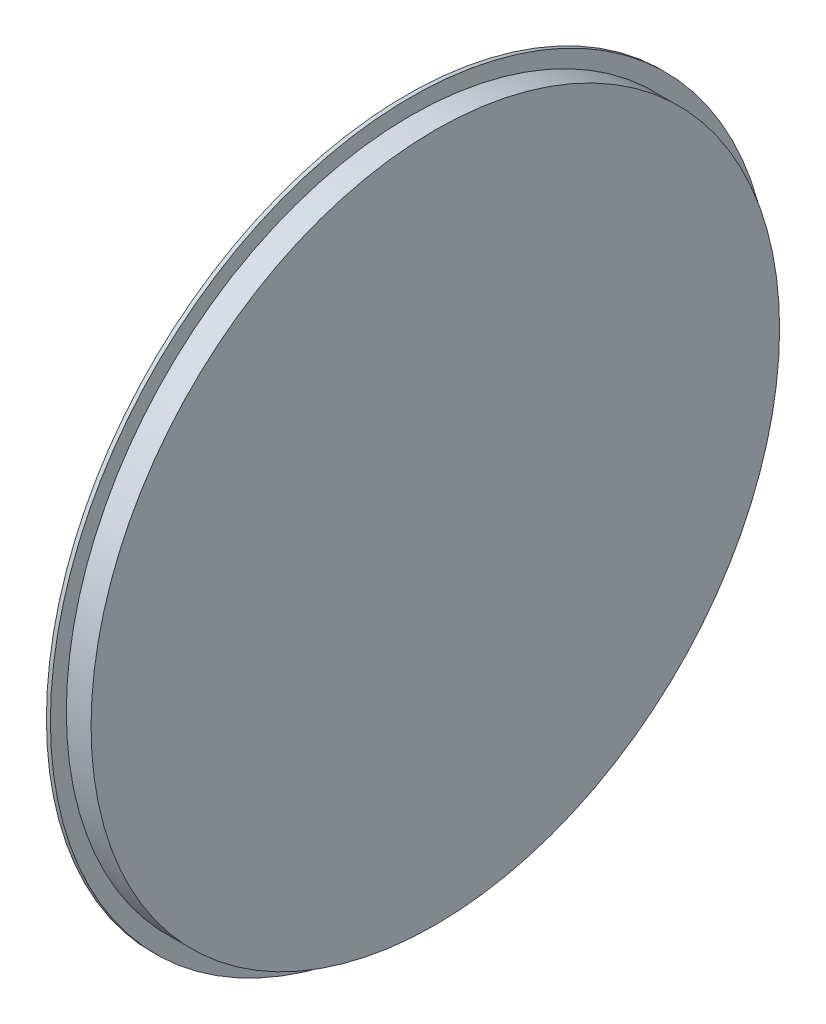
from build123d import *

# Parameters (mm, degrees)
SKETCH2_W          = 6.838461538
SKETCH2_H          = 38.1
CUT_EXTRUDE1_DEPTH = 1.27


with BuildPart() as part:
    # Sketch1 → Revolve1 (revolve)
    with BuildSketch(Plane.XY, mode=Mode.PRIVATE) as revolve1_sk:
        Polygon((0, 0), (0, 274.193), (-19.685, 274.193), (-19.685, 286.893), (-22.86, 286.893), (-22.86, 0), align=None)
    revolve(revolve1_sk.sketch.rotate(Axis((0, 0, 0), (1, 0, 0)), 90), axis=Axis((0, 0, 0), (1, 0, 0)))

    # Sketch2 → Cut-Extrude1 (cut)
    # profile 1 of 18: a face of its own
    with BuildSketch(Plane.ZY.offset(22.86)):
        with BuildLine():
            Line((-199.668312995, 52.594298579), (-191.700284149, 52.594298579))
            add(Edge.make_bspline(
                [(-191.700284149, 52.594298579), (-191.173599867, 52.592429152), (-190.160637635, 52.588833718), (-188.700001424, 52.532107284), (-187.358206193, 52.453167796), (-186.133265294, 52.332704041), (-185.025702777, 52.172983664), (-184.034408605, 51.98469977), (-183.159411753, 51.770109905), (-182.393332831, 51.502714003), (-181.701984485, 51.201095479), (-181.057551711, 50.854530265), (-180.445817363, 50.466877474), (-179.870870225, 50.02793691), (-179.327713872, 49.545605008), (-178.815323605, 49.019396252), (-178.340939974, 48.444848609), (-177.907500383, 47.825592492), (-177.512455085, 47.174149256), (-177.163317896, 46.489624467), (-176.879398955, 45.771542083), (-176.628526134, 45.030279947), (-176.447830569, 44.255241571), (-176.322159447, 43.453972085), (-176.230147967, 42.623650935), (-176.224857747, 42.059567612), (-176.222159149, 41.771822618)],
                knots=[0, 0, 0, 0, 1.749336639, 3.364467119, 4.854658419, 6.213483162, 7.451590619, 8.570285859, 9.5643256, 10.440900261, 11.26203566, 12.067320669, 12.869050712, 13.665104639, 14.467235401, 15.27997916, 16.102287765, 16.939272006, 17.78853747, 18.631303466, 19.488103222, 20.351255419, 21.228522269, 22.127379805, 23.044756219, 24, 24, 24, 24], degree=3))
            add(Edge.make_bspline(
                [(-176.222159149, 41.771822618), (-176.229169137, 41.471482946), (-176.242914446, 40.882571588), (-176.31695416, 40.017508836), (-176.4522755, 39.189877303), (-176.657239354, 38.402100192), (-176.892818683, 37.6443727), (-177.206078761, 36.930675372), (-177.55962372, 36.250628515), (-177.979518738, 35.613851648), (-178.440333008, 35.006200687), (-178.97625031, 34.450956993), (-179.552551435, 33.918278319), (-180.201632368, 33.441529852), (-180.894881019, 32.988475583), (-181.646071509, 32.577887761), (-182.450301312, 32.199445156), (-183.015714691, 31.988399418), (-183.304851456, 31.880476464)],
                knots=[0, 0, 0, 0, 1.099860209, 2.156625411, 3.176576793, 4.16617041, 5.135385252, 6.078461593, 7.016046972, 7.938469504, 8.868247731, 9.803980173, 10.76021508, 11.73834243, 12.748633912, 13.790971185, 14.870363756, 16, 16, 16, 16], degree=3))
            Line((-183.304851456, 31.880476464), (-174.512543764, 14.494298579))
            Line((-174.512543764, 14.494298579), (-182.114226456, 14.494298579))
            Line((-182.114226456, 14.494298579), (-190.509659149, 31.101990887))
            Line((-190.509659149, 31.101990887), (-192.829851456, 31.101990887))
            Line((-192.829851456, 31.101990887), (-192.829851456, 14.494298579))
            Line((-192.829851456, 14.494298579), (-199.668312995, 14.494298579))
            Line((-199.668312995, 14.494298579), (-199.668312995, 52.594298579))
        make_face()
        with BuildLine():
            Line((-192.829851456, 37.940452426), (-190.166209629, 37.940452426))
            add(Edge.make_bspline(
                [(-190.166209629, 37.940452426), (-189.840557275, 37.944120141), (-189.217002989, 37.951143029), (-188.320250028, 37.983718092), (-187.505784475, 38.062207897), (-186.77010874, 38.161376833), (-186.109520971, 38.275881691), (-185.529913375, 38.439974104), (-185.022355087, 38.615803279), (-184.592860689, 38.834313332), (-184.225910544, 39.082806656), (-183.909072581, 39.365101249), (-183.647002156, 39.691821295), (-183.431304829, 40.054087953), (-183.263515759, 40.455105382), (-183.141042593, 40.89047132), (-183.072598204, 41.365145143), (-183.064723444, 41.692734715), (-183.060620687, 41.863409156)],
                knots=[0, 0, 0, 0, 1.688639943, 3.233382647, 4.650958383, 5.928841754, 7.082724185, 8.122798841, 9.049171256, 9.863274652, 10.613301712, 11.341792392, 12.054588806, 12.776240173, 13.521029143, 14.301969904, 15.115324896, 16, 16, 16, 16], degree=3))
            add(Edge.make_bspline(
                [(-183.060620687, 41.863409156), (-183.068377324, 42.06532948), (-183.083613801, 42.461964539), (-183.234806983, 43.032979946), (-183.47547387, 43.561493773), (-183.805362255, 44.045118064), (-184.220813788, 44.469096504), (-184.697577199, 44.842836874), (-185.245942195, 45.138362794), (-185.753686916, 45.333288545), (-186.215615932, 45.449914632), (-186.632492294, 45.536823361), (-187.115237632, 45.598418071), (-187.664216392, 45.663750226), (-188.278029207, 45.706114821), (-188.960021725, 45.737032532), (-189.708235269, 45.749682486), (-190.229811172, 45.753726453), (-190.502026937, 45.755837041)],
                knots=[0, 0, 0, 0, 1.020303359, 2.004196876, 2.966617323, 3.9489082, 4.950758222, 5.960522915, 7.003732012, 8.091992268, 8.70421221, 9.413913587, 10.24622431, 11.166358409, 12.212345909, 13.359657661, 14.621978493, 16, 16, 16, 16], degree=3))
            Line((-190.502026937, 45.755837041), (-192.829851456, 45.755837041))
            Line((-192.829851456, 45.755837041), (-192.829851456, 37.940452426))
        make_face(mode=Mode.SUBTRACT)
    # profile 2 of 18: a face of its own
    with BuildSketch(Plane.ZY.offset(22.86)):
        Polygon((-168.895236072, 52.594298579), (-148.379851456, 52.594298579), (-148.379851456, 45.755837041), (-162.056774533, 45.755837041), (-162.056774533, 38.428913964), (-148.379851456, 38.428913964), (-148.379851456, 31.590452426), (-162.056774533, 31.590452426), (-162.056774533, 21.332760118), (-148.379851456, 21.332760118), (-148.379851456, 14.494298579), (-168.895236072, 14.494298579), align=None)
    # profile 3 of 18: a face of its own
    with BuildSketch(Plane.ZY.offset(22.86)):
        Polygon((-138.52666636, 52.594298579), (-131.443974053, 52.594298579), (-122.735620687, 26.018938002), (-113.981474053, 52.594298579), (-106.952207226, 52.594298579), (-100.510620687, 14.494298579), (-107.433036553, 14.494298579), (-111.501005303, 38.55866156), (-119.423240879, 14.494298579), (-126.086161553, 14.494298579), (-133.970236072, 38.55866156), (-138.03057261, 14.494298579), (-144.960620687, 14.494298579), align=None)
    # profile 4 of 18: a face of its own
    with BuildSketch(Plane.ZY.offset(22.86)):
        with BuildLine():
            add(Edge.make_bspline(
                [(-76.255452418, 53.571221656), (-75.593037224, 53.554070541), (-74.285279597, 53.520210354), (-72.362040049, 53.23795927), (-70.508643138, 52.778071592), (-68.725926966, 52.138794457), (-67.018355248, 51.302812992), (-65.379904809, 50.293827818), (-63.816444499, 49.092794946), (-62.343995406, 47.72773249), (-60.983186883, 46.243286675), (-59.804045502, 44.645016841), (-58.798516991, 42.974335765), (-57.965132271, 41.22676681), (-57.330354688, 39.390207225), (-56.884905002, 37.474021039), (-56.598725648, 35.478753387), (-56.565810619, 34.120248075), (-56.549082226, 33.429815406)],
                knots=[0, 0, 0, 0, 1.014329547, 2.002516266, 2.970391464, 3.935626869, 4.897733899, 5.877609409, 6.878433252, 7.912639331, 8.949961323, 9.958554974, 10.949718813, 11.932905612, 12.9188844, 13.919928257, 14.942845884, 16, 16, 16, 16], degree=3))
            add(Edge.make_bspline(
                [(-56.549082226, 33.429815406), (-56.566897241, 32.74716232), (-56.6020023, 31.40197251), (-56.873221908, 29.425092036), (-57.326173022, 27.529432196), (-57.95018428, 25.710702121), (-58.768454552, 23.977711115), (-59.754374162, 22.319394273), (-60.933959655, 20.751141172), (-62.264186914, 19.273793395), (-63.728651685, 17.932783283), (-65.279752358, 16.751020438), (-66.910326909, 15.7496392), (-68.617988696, 14.929098249), (-70.406399719, 14.292306636), (-72.271142384, 13.843003882), (-74.212101301, 13.569953526), (-75.532047491, 13.535077769), (-76.202026937, 13.517375502)],
                knots=[0, 0, 0, 0, 1.051557043, 2.072126891, 3.067553643, 4.050577992, 5.02905126, 6.015227836, 7.017913613, 8.04756643, 9.074058332, 10.072836633, 11.047628519, 12.017157415, 12.98668631, 13.966869689, 14.968021931, 16, 16, 16, 16], degree=3))
            add(Edge.make_bspline(
                [(-76.202026937, 13.517375502), (-76.902745104, 13.533255308), (-78.279560522, 13.564456957), (-80.29453605, 13.861170387), (-82.225056714, 14.308124464), (-84.05490503, 14.975179446), (-85.802716438, 15.809054265), (-87.455649254, 16.836021097), (-89.013147984, 18.054382803), (-90.466278562, 19.432936685), (-91.782818384, 20.941376994), (-92.944923018, 22.534910414), (-93.925184055, 24.201363751), (-94.723637363, 25.941516939), (-95.353105876, 27.744555352), (-95.797124392, 29.621460011), (-96.059416724, 31.56772942), (-96.095952523, 32.889674508), (-96.114466841, 33.559563002)],
                knots=[0, 0, 0, 0, 1.067978421, 2.098431617, 3.099715153, 4.085208694, 5.062210972, 6.048429807, 7.046490867, 8.072918869, 9.098532598, 10.095778865, 11.076610158, 12.041847152, 13.011192615, 13.984257998, 14.978533688, 16, 16, 16, 16], degree=3))
            add(Edge.make_bspline(
                [(-96.114466841, 33.559563002), (-96.108655982, 34.010228912), (-96.097107841, 34.905854268), (-95.957998329, 36.233125328), (-95.757720626, 37.534489839), (-95.461519407, 38.804759242), (-95.101710631, 40.052894696), (-94.635527535, 41.267278248), (-94.104885012, 42.460882853), (-93.484879186, 43.619610547), (-92.795492657, 44.732800067), (-92.043310575, 45.795200304), (-91.22644159, 46.793965284), (-90.347517106, 47.735658481), (-89.403508232, 48.614090077), (-88.406832428, 49.441695494), (-87.338159988, 50.196490589), (-86.220880798, 50.896908964), (-85.061293821, 51.530285154), (-83.864119629, 52.069396024), (-82.654022373, 52.540192365), (-81.414836788, 52.911765653), (-80.159842951, 53.214408209), (-78.875633795, 53.414550925), (-77.57381142, 53.553656585), (-76.695948328, 53.565352737), (-76.255452418, 53.571221656)],
                knots=[0, 0, 0, 0, 1.034744296, 2.056386356, 3.06226378, 4.057406941, 5.050368692, 6.043467995, 7.042652155, 8.049140477, 9.059438543, 10.048523776, 11.036952808, 12.020949711, 13.004946614, 13.997082645, 14.994316842, 16.007702937, 17.024872941, 18.026463647, 19.021641123, 20.005082605, 20.995858141, 21.984425357, 22.988620895, 24, 24, 24, 24], degree=3))
        make_face()
        with BuildLine():
            add(Edge.make_bspline(
                [(-76.362303379, 46.732760118), (-76.808108717, 46.72079816), (-77.687950059, 46.697190041), (-78.978517074, 46.517328107), (-80.217506986, 46.230068155), (-81.398051582, 45.813975625), (-82.525267446, 45.284395439), (-83.601152782, 44.643178014), (-84.610808803, 43.868282218), (-85.567698295, 43.001308753), (-86.432090494, 42.035301069), (-87.19580827, 41.00005955), (-87.834917038, 39.89731303), (-88.370174635, 38.737305765), (-88.773104976, 37.506993779), (-89.060100177, 36.21601424), (-89.241470431, 34.862142726), (-89.264332377, 33.939210278), (-89.276005303, 33.467976464)],
                knots=[0, 0, 0, 0, 1.033739768, 2.040188636, 3.016340934, 3.979330865, 4.937572243, 5.900995986, 6.878200029, 7.884839167, 8.891893314, 9.879764717, 10.863503415, 11.843163062, 12.837761627, 13.859916423, 14.907309254, 16, 16, 16, 16], degree=3))
            add(Edge.make_bspline(
                [(-89.276005303, 33.467976464), (-89.260528785, 32.945743396), (-89.230197375, 31.922253112), (-89.016781887, 30.429213061), (-88.65164923, 29.019184918), (-88.124404773, 27.699064918), (-87.470483323, 26.454194118), (-86.658416664, 25.299830179), (-85.701356435, 24.229061309), (-84.964044987, 23.603901842), (-84.589827418, 23.286606272)],
                knots=[0, 0, 0, 0, 1.078454662, 2.113592447, 3.107694534, 4.079536787, 5.043276885, 6.005368276, 6.987637804, 8, 8, 8, 8], degree=3))
            add(Edge.make_bspline(
                [(-84.589827418, 23.286606272), (-84.283271786, 23.052200491), (-83.677067273, 22.588670131), (-82.709432888, 21.994560884), (-81.712960008, 21.485349994), (-80.680128995, 21.073913618), (-79.613121136, 20.750284681), (-78.512082749, 20.523652658), (-77.378573914, 20.381421464), (-76.612042117, 20.364422142), (-76.224923572, 20.355837041)],
                knots=[0, 0, 0, 0, 1.023928204, 2.024787132, 3.009472467, 3.9914905, 4.972207045, 5.96565515, 6.972602802, 8, 8, 8, 8], degree=3))
            add(Edge.make_bspline(
                [(-76.224923572, 20.355837041), (-75.786783868, 20.367900423), (-74.92473022, 20.391635507), (-73.658187807, 20.569283242), (-72.444801707, 20.869927349), (-71.277039117, 21.282369768), (-70.158267341, 21.818599291), (-69.093954125, 22.47970527), (-68.082233434, 23.257570172), (-67.126563006, 24.135928898), (-66.253035059, 25.105741984), (-65.490911004, 26.146505375), (-64.831481771, 27.235287938), (-64.307354864, 28.387499741), (-63.888505656, 29.592264442), (-63.604964591, 30.854917685), (-63.42206217, 32.170254334), (-63.399193783, 33.065387407), (-63.387543764, 33.521401945)],
                knots=[0, 0, 0, 0, 1.026359118, 2.019393844, 2.989460624, 3.950973911, 4.916101784, 5.890408035, 6.881132271, 7.902007068, 8.92769091, 9.933912415, 10.920395702, 11.90457117, 12.894218921, 13.903490204, 14.931958862, 16, 16, 16, 16], degree=3))
            add(Edge.make_bspline(
                [(-63.387543764, 33.521401945), (-63.399596875, 33.974794273), (-63.423321586, 34.867227925), (-63.601281991, 36.179182853), (-63.900019491, 37.436261852), (-64.313700431, 38.640517866), (-64.841949086, 39.793131512), (-65.495182138, 40.890049519), (-66.271107472, 41.930211436), (-67.151867215, 42.906528957), (-68.110520062, 43.803702221), (-69.139729682, 44.582285524), (-70.210697633, 45.258849659), (-71.347997145, 45.788842684), (-72.528360024, 46.211087002), (-73.758988905, 46.522033777), (-75.04454487, 46.695926502), (-75.919135175, 46.720372805), (-76.362303379, 46.732760118)],
                knots=[0, 0, 0, 0, 1.055025985, 2.07665775, 3.074803781, 4.057872707, 5.035505728, 6.020516407, 7.023567878, 8.050795229, 9.077271434, 10.074415901, 11.050397877, 12.019801805, 12.988065821, 13.964604439, 14.968634123, 16, 16, 16, 16], degree=3))
        make_face(mode=Mode.SUBTRACT)
    # profile 5 of 18: a face of its own
    with BuildSketch(Plane.ZY.offset(22.86)):
        Polygon((-52.885620687, 52.594298579), (-45.581594245, 52.594298579), (-35.789466841, 25.530476464), (-25.989707226, 52.594298579), (-18.693312995, 52.594298579), (-32.499983668, 14.494298579), (-39.094214437, 14.494298579), align=None)
    # profile 6 of 18: a face of its own
    with BuildSketch(Plane.ZY.offset(22.86)):
        Polygon((-12.587543764, 52.594298579), (7.927840851, 52.594298579), (7.927840851, 45.755837041), (-5.749082226, 45.755837041), (-5.749082226, 38.428913964), (7.927840851, 38.428913964), (7.927840851, 31.590452426), (-5.749082226, 31.590452426), (-5.749082226, 21.332760118), (7.927840851, 21.332760118), (7.927840851, 14.494298579), (-12.587543764, 14.494298579), align=None)
    # profile 7 of 18: a face of its own
    with BuildSketch(Plane.ZY.offset(22.86)):
        with BuildLine():
            Line((29.420148544, 14.494298579), (29.420148544, 52.594298579))
            Line((29.420148544, 52.594298579), (35.525917774, 52.594298579))
            add(Edge.make_bspline(
                [(35.525917774, 52.594298579), (35.953359798, 52.594347361), (36.780452011, 52.594441753), (37.973730222, 52.55253774), (39.080394987, 52.498330204), (40.096924471, 52.437684578), (41.025048876, 52.333180046), (41.863356839, 52.223043686), (42.613523303, 52.090226023), (43.077310464, 51.971084464), (43.295509121, 51.915031752)],
                knots=[0, 0, 0, 0, 1.311965854, 2.538629056, 3.664479157, 4.713267157, 5.663616078, 6.530575999, 7.308677837, 8, 8, 8, 8], degree=3))
            add(Edge.make_bspline(
                [(43.295509121, 51.915031752), (43.582026111, 51.835968404), (44.144264425, 51.680820733), (44.949569115, 51.367493306), (45.713512947, 51.019207657), (46.435163166, 50.621878871), (47.110088554, 50.170710076), (47.735724163, 49.662120661), (48.325563405, 49.116525383), (48.858662436, 48.518718658), (49.340496126, 47.887025115), (49.759123214, 47.221610275), (50.122856497, 46.532648766), (50.413938398, 45.811470465), (50.633263141, 45.061396594), (50.793676343, 44.285630084), (50.89764582, 43.481716219), (50.907469572, 42.93478734), (50.912456236, 42.657159156)],
                knots=[0, 0, 0, 0, 1.099996261, 2.158545794, 3.195537121, 4.207578794, 5.205712374, 6.197378256, 7.190519799, 8.17788031, 9.159561366, 10.129234751, 11.085776129, 12.040971148, 13.00380137, 13.975669004, 14.972423361, 16, 16, 16, 16], degree=3))
            add(Edge.make_bspline(
                [(50.912456236, 42.657159156), (50.899417592, 42.300479813), (50.873752623, 41.598400349), (50.709803052, 40.567172638), (50.402372063, 39.592514229), (50.00010609, 38.656462535), (49.453150133, 37.762509037), (48.75862185, 36.911078784), (47.927770324, 36.075954962), (47.290461338, 35.575354563), (46.958970659, 35.314971656)],
                knots=[0, 0, 0, 0, 0.986156485, 1.941127874, 2.875419072, 3.804401753, 4.751181392, 5.761612777, 6.835722519, 8, 8, 8, 8], degree=3))
            add(Edge.make_bspline(
                [(46.958970659, 35.314971656), (47.227594803, 35.177841361), (47.754292429, 34.90896679), (48.502048323, 34.467017259), (49.194388658, 33.996947883), (49.834417676, 33.508216645), (50.408710037, 32.980105521), (50.940979237, 32.443044998), (51.404965876, 31.866263743), (51.819876713, 31.270319337), (52.180510469, 30.646582436), (52.494582702, 29.996106392), (52.759868252, 29.316669037), (52.984518918, 28.611728157), (53.152063443, 27.878859084), (53.261306037, 27.117799715), (53.344948995, 26.331145649), (53.351455631, 25.795296544), (53.354763928, 25.522844252)],
                knots=[0, 0, 0, 0, 1.164658916, 2.283573913, 3.35186032, 4.395461096, 5.390182219, 6.362969632, 7.312859996, 8.245001507, 9.165155236, 10.092416118, 11.032087915, 11.979892451, 12.947605196, 13.931445124, 14.948243989, 16, 16, 16, 16], degree=3))
            add(Edge.make_bspline(
                [(53.354763928, 25.522844252), (53.333295293, 25.002475952), (53.290927027, 23.975531199), (52.981150941, 22.467740448), (52.444097638, 21.038218058), (51.722945796, 19.692645566), (50.834347975, 18.469975084), (49.812715303, 17.398926358), (48.668333277, 16.492307388), (47.612502541, 15.880409916), (46.699292102, 15.469769493), (45.942896957, 15.215885688), (45.130544605, 14.980688114), (44.2473547, 14.815527522), (43.309338273, 14.664354387), (42.307349603, 14.571016961), (41.243261388, 14.507764488), (40.512399606, 14.498877963), (40.135773544, 14.494298579)],
                knots=[0, 0, 0, 0, 1.284142165, 2.534249414, 3.780121997, 5.041676246, 6.291546858, 7.49970053, 8.684500223, 9.883330709, 10.50184324, 11.153274765, 11.851151195, 12.587658647, 13.369265475, 14.195992086, 15.070362669, 16, 16, 16, 16], degree=3))
            Line((40.135773544, 14.494298579), (29.420148544, 14.494298579))
        make_face()
        with BuildLine():
            Line((36.258610082, 45.755837041), (36.258610082, 37.451990887))
            Line((36.258610082, 37.451990887), (38.075076428, 37.451990887))
            add(Edge.make_bspline(
                [(38.075076428, 37.451990887), (38.321950525, 37.454143723), (38.798526027, 37.458299641), (39.48688879, 37.511826431), (40.126954993, 37.60314646), (40.716297002, 37.730560871), (41.260404754, 37.892358597), (41.75580233, 38.087036106), (42.200311558, 38.324563827), (42.716728471, 38.678371849), (43.262618389, 39.199016195), (43.743159144, 39.951194824), (44.02619444, 40.816197387), (44.057716939, 41.426264172), (44.073994697, 41.741293772)],
                knots=[0, 0, 0, 0, 1.065314748, 2.056525647, 2.977365736, 3.853934255, 4.656397591, 5.425096493, 6.14721249, 6.826394842, 8.123232004, 9.372140726, 10.643011755, 12, 12, 12, 12], degree=3))
            add(Edge.make_bspline(
                [(44.073994697, 41.741293772), (44.06096951, 42.036371334), (44.035785835, 42.606891942), (43.750805682, 43.407953686), (43.308175165, 44.117858338), (42.785587627, 44.603730017), (42.293469912, 44.935566049), (41.872088525, 45.154065945), (41.409590812, 45.349664819), (40.897023311, 45.499224485), (40.337313065, 45.611448792), (39.733178898, 45.693864106), (39.083578471, 45.749959475), (38.634898074, 45.753835828), (38.403261524, 45.755837041)],
                knots=[0, 0, 0, 0, 1.347982417, 2.606269829, 3.849316587, 5.153353503, 5.842674298, 6.568177932, 7.326619318, 8.142485038, 9.012069166, 9.942760135, 10.937925643, 12, 12, 12, 12], degree=3))
            Line((38.403261524, 45.755837041), (36.258610082, 45.755837041))
        make_face(mode=Mode.SUBTRACT)
        with BuildLine():
            Line((36.258610082, 31.101990887), (36.258610082, 21.332760118))
            Line((36.258610082, 21.332760118), (38.227720659, 21.332760118))
            add(Edge.make_bspline(
                [(38.227720659, 21.332760118), (38.617016327, 21.33498415), (39.365485827, 21.339260128), (40.43766706, 21.390924116), (41.412547846, 21.484039351), (42.287545119, 21.600286222), (43.063999103, 21.757782549), (43.739285197, 21.958018945), (44.322664076, 22.178313857), (44.81063777, 22.450404229), (45.209284323, 22.767049949), (45.569021041, 23.090669481), (45.862327945, 23.463995185), (46.094397841, 23.871001225), (46.295253927, 24.301577275), (46.416396133, 24.772537176), (46.508629558, 25.269922806), (46.51370541, 25.613953689), (46.51630239, 25.789971656)],
                knots=[0, 0, 0, 0, 1.753078804, 3.370512758, 4.83203934, 6.162291463, 7.344201807, 8.395507345, 9.331626367, 10.147333109, 10.898971645, 11.62040215, 12.321813352, 13.025280112, 13.727906689, 14.453419512, 15.208716525, 16, 16, 16, 16], degree=3))
            add(Edge.make_bspline(
                [(46.51630239, 25.789971656), (46.510575304, 25.99125097), (46.499420483, 26.383288926), (46.408318919, 26.956294238), (46.242757619, 27.491232716), (46.034225083, 28.001783458), (45.744040981, 28.469666969), (45.399167092, 28.911074924), (44.982471392, 29.311059886), (44.513872769, 29.693814441), (43.967298869, 30.028936791), (43.342493256, 30.31971479), (42.636061645, 30.562561866), (41.845815789, 30.755916867), (40.975220066, 30.920014584), (40.017920083, 31.017999036), (38.981888566, 31.09087438), (38.263487452, 31.098201187), (37.891903351, 31.101990887)],
                knots=[0, 0, 0, 0, 0.845221588, 1.646264278, 2.427170338, 3.19324141, 3.95557735, 4.731569926, 5.540061037, 6.376114724, 7.268642756, 8.224665384, 9.265483498, 10.400594375, 11.639216012, 12.983232105, 14.439614077, 16, 16, 16, 16], degree=3))
            Line((37.891903351, 31.101990887), (36.258610082, 31.101990887))
        make_face(mode=Mode.SUBTRACT)
    # profile 8 of 18: a face of its own
    with BuildSketch(Plane.ZY.offset(22.86)):
        Polygon((60.193225467, 52.594298579), (80.708610082, 52.594298579), (80.708610082, 45.755837041), (67.031687005, 45.755837041), (67.031687005, 38.428913964), (80.708610082, 38.428913964), (80.708610082, 31.590452426), (67.031687005, 31.590452426), (67.031687005, 21.332760118), (80.708610082, 21.332760118), (80.708610082, 14.494298579), (60.193225467, 14.494298579), align=None)
    # profile 9 of 18: a face of its own
    with BuildSketch(Plane.ZY.offset(22.86)):
        Polygon((87.547071621, 52.594298579), (106.108610082, 52.594298579), (106.108610082, 45.755837041), (94.385533159, 45.755837041), (94.385533159, 38.428913964), (106.108610082, 38.428913964), (106.108610082, 31.590452426), (94.385533159, 31.590452426), (94.385533159, 14.494298579), (87.547071621, 14.494298579), align=None)
    # profile 10 of 18: a face of its own
    with BuildSketch(Plane.ZY.offset(22.86)):
        with BuildLine():
            add(Edge.make_bspline(
                [(130.85223989, 53.571221656), (131.514655084, 53.554070541), (132.822412711, 53.520210354), (134.745652259, 53.23795927), (136.59904917, 52.778071592), (138.381765342, 52.138794457), (140.089337059, 51.302812992), (141.727787499, 50.293827818), (143.291247809, 49.092794946), (144.763696902, 47.72773249), (146.124505425, 46.243286675), (147.303646805, 44.645016841), (148.309175316, 42.974335765), (149.142560037, 41.22676681), (149.77733762, 39.390207225), (150.222787306, 37.474021039), (150.50896666, 35.478753387), (150.541881689, 34.120248075), (150.558610082, 33.429815406)],
                knots=[0, 0, 0, 0, 1.014329547, 2.002516266, 2.970391464, 3.935626869, 4.897733899, 5.877609409, 6.878433252, 7.912639331, 8.949961323, 9.958554974, 10.949718813, 11.932905612, 12.9188844, 13.919928257, 14.942845884, 16, 16, 16, 16], degree=3))
            add(Edge.make_bspline(
                [(150.558610082, 33.429815406), (150.540795067, 32.74716232), (150.505690008, 31.40197251), (150.2344704, 29.425092036), (149.781519285, 27.529432196), (149.157508028, 25.710702121), (148.339237756, 23.977711115), (147.353318146, 22.319394273), (146.173732653, 20.751141172), (144.843505394, 19.273793395), (143.379040623, 17.932783283), (141.82793995, 16.751020438), (140.197365399, 15.7496392), (138.489703611, 14.929098249), (136.701292588, 14.292306636), (134.836549923, 13.843003882), (132.895591007, 13.569953526), (131.575644817, 13.535077769), (130.905665371, 13.517375502)],
                knots=[0, 0, 0, 0, 1.051557043, 2.072126891, 3.067553643, 4.050577992, 5.02905126, 6.015227836, 7.017913613, 8.04756643, 9.074058332, 10.072836633, 11.047628519, 12.017157415, 12.98668631, 13.966869689, 14.968021931, 16, 16, 16, 16], degree=3))
            add(Edge.make_bspline(
                [(130.905665371, 13.517375502), (130.204947204, 13.533255308), (128.828131786, 13.564456957), (126.813156258, 13.861170387), (124.882635593, 14.308124464), (123.052787278, 14.975179446), (121.30497587, 15.809054265), (119.652043054, 16.836021097), (118.094544323, 18.054382803), (116.641413746, 19.432936685), (115.324873923, 20.941376994), (114.16276929, 22.534910414), (113.182508252, 24.201363751), (112.384054945, 25.941516939), (111.754586432, 27.744555352), (111.310567916, 29.621460011), (111.048275583, 31.56772942), (111.011739784, 32.889674508), (110.993225467, 33.559563002)],
                knots=[0, 0, 0, 0, 1.067978421, 2.098431617, 3.099715153, 4.085208694, 5.062210972, 6.048429807, 7.046490867, 8.072918869, 9.098532598, 10.095778865, 11.076610158, 12.041847152, 13.011192615, 13.984257998, 14.978533688, 16, 16, 16, 16], degree=3))
            add(Edge.make_bspline(
                [(110.993225467, 33.559563002), (110.999036326, 34.010228912), (111.010584466, 34.905854268), (111.149693979, 36.233125328), (111.349971682, 37.534489839), (111.646172901, 38.804759242), (112.005981677, 40.052894696), (112.472164772, 41.267278248), (113.002807295, 42.460882853), (113.622813122, 43.619610547), (114.312199651, 44.732800067), (115.064381732, 45.795200304), (115.881250718, 46.793965284), (116.760175201, 47.735658481), (117.704184076, 48.614090077), (118.700859879, 49.441695494), (119.76953232, 50.196490589), (120.88681151, 50.896908964), (122.046398486, 51.530285154), (123.243572679, 52.069396024), (124.453669934, 52.540192365), (125.692855519, 52.911765653), (126.947849356, 53.214408209), (128.232058512, 53.414550925), (129.533880888, 53.553656585), (130.411743979, 53.565352737), (130.85223989, 53.571221656)],
                knots=[0, 0, 0, 0, 1.034744296, 2.056386356, 3.06226378, 4.057406941, 5.050368692, 6.043467995, 7.042652155, 8.049140477, 9.059438543, 10.048523776, 11.036952808, 12.020949711, 13.004946614, 13.997082645, 14.994316842, 16.007702937, 17.024872941, 18.026463647, 19.021641123, 20.005082605, 20.995858141, 21.984425357, 22.988620895, 24, 24, 24, 24], degree=3))
        make_face()
        with BuildLine():
            add(Edge.make_bspline(
                [(130.745388928, 46.732760118), (130.29958359, 46.72079816), (129.419742249, 46.697190041), (128.129175233, 46.517328107), (126.890185322, 46.230068155), (125.709640726, 45.813975625), (124.582424862, 45.284395439), (123.506539526, 44.643178014), (122.496883505, 43.868282218), (121.539994012, 43.001308753), (120.675601814, 42.035301069), (119.911884038, 41.00005955), (119.27277527, 39.89731303), (118.737517673, 38.737305765), (118.334587332, 37.506993779), (118.047592131, 36.21601424), (117.866221877, 34.862142726), (117.843359931, 33.939210278), (117.831687005, 33.467976464)],
                knots=[0, 0, 0, 0, 1.033739768, 2.040188636, 3.016340934, 3.979330865, 4.937572243, 5.900995986, 6.878200029, 7.884839167, 8.891893314, 9.879764717, 10.863503415, 11.843163062, 12.837761627, 13.859916423, 14.907309254, 16, 16, 16, 16], degree=3))
            add(Edge.make_bspline(
                [(117.831687005, 33.467976464), (117.847163523, 32.945743396), (117.877494932, 31.922253112), (118.090910421, 30.429213061), (118.456043077, 29.019184918), (118.983287534, 27.699064918), (119.637208985, 26.454194118), (120.449275643, 25.299830179), (121.406335873, 24.229061309), (122.14364732, 23.603901842), (122.51786489, 23.286606272)],
                knots=[0, 0, 0, 0, 1.078454662, 2.113592447, 3.107694534, 4.079536787, 5.043276885, 6.005368276, 6.987637804, 8, 8, 8, 8], degree=3))
            add(Edge.make_bspline(
                [(122.51786489, 23.286606272), (122.824420522, 23.052200491), (123.430625035, 22.588670131), (124.39825942, 21.994560884), (125.3947323, 21.485349994), (126.427563312, 21.073913618), (127.494571172, 20.750284681), (128.595609558, 20.523652658), (129.729118394, 20.381421464), (130.49565019, 20.364422142), (130.882768736, 20.355837041)],
                knots=[0, 0, 0, 0, 1.023928204, 2.024787132, 3.009472467, 3.9914905, 4.972207045, 5.96565515, 6.972602802, 8, 8, 8, 8], degree=3))
            add(Edge.make_bspline(
                [(130.882768736, 20.355837041), (131.32090844, 20.367900423), (132.182962088, 20.391635507), (133.449504501, 20.569283242), (134.662890601, 20.869927349), (135.830653191, 21.282369768), (136.949424966, 21.818599291), (138.013738183, 22.47970527), (139.025458873, 23.257570172), (139.981129301, 24.135928898), (140.854657248, 25.105741984), (141.616781303, 26.146505375), (142.276210537, 27.235287938), (142.800337444, 28.387499741), (143.219186652, 29.592264442), (143.502727716, 30.854917685), (143.685630138, 32.170254334), (143.708498525, 33.065387407), (143.720148544, 33.521401945)],
                knots=[0, 0, 0, 0, 1.026359118, 2.019393844, 2.989460624, 3.950973911, 4.916101784, 5.890408035, 6.881132271, 7.902007068, 8.92769091, 9.933912415, 10.920395702, 11.90457117, 12.894218921, 13.903490204, 14.931958862, 16, 16, 16, 16], degree=3))
            add(Edge.make_bspline(
                [(143.720148544, 33.521401945), (143.708095433, 33.974794273), (143.684370722, 34.867227925), (143.506410317, 36.179182853), (143.207672817, 37.436261852), (142.793991877, 38.640517866), (142.265743221, 39.793131512), (141.61251017, 40.890049519), (140.836584836, 41.930211436), (139.955825093, 42.906528957), (138.997172245, 43.803702221), (137.967962626, 44.582285524), (136.896994675, 45.258849659), (135.759695162, 45.788842684), (134.579332284, 46.211087002), (133.348703403, 46.522033777), (132.063147437, 46.695926502), (131.188557133, 46.720372805), (130.745388928, 46.732760118)],
                knots=[0, 0, 0, 0, 1.055025985, 2.07665775, 3.074803781, 4.057872707, 5.035505728, 6.020516407, 7.023567878, 8.050795229, 9.077271434, 10.074415901, 11.050397877, 12.019801805, 12.988065821, 13.964604439, 14.968634123, 16, 16, 16, 16], degree=3))
        make_face(mode=Mode.SUBTRACT)
    # profile 11 of 18: a face of its own
    with BuildSketch(Plane.ZY.offset(22.86)):
        with BuildLine():
            Line((157.397071621, 52.594298579), (165.365100467, 52.594298579))
            add(Edge.make_bspline(
                [(165.365100467, 52.594298579), (165.891784748, 52.592429152), (166.90474698, 52.588833718), (168.365383192, 52.532107284), (169.707178422, 52.453167796), (170.932119321, 52.332704041), (172.039681838, 52.172983664), (173.03097601, 51.98469977), (173.905972862, 51.770109905), (174.672051785, 51.502714003), (175.36340013, 51.201095479), (176.007832904, 50.854530265), (176.619567252, 50.466877474), (177.19451439, 50.02793691), (177.737670744, 49.545605008), (178.250061011, 49.019396252), (178.724444641, 48.444848609), (179.157884233, 47.825592492), (179.552929531, 47.174149256), (179.902066719, 46.489624467), (180.185985661, 45.771542083), (180.436858481, 45.030279947), (180.617554046, 44.255241571), (180.743225169, 43.453972085), (180.835236648, 42.623650935), (180.840526868, 42.059567612), (180.843225467, 41.771822618)],
                knots=[0, 0, 0, 0, 1.749336639, 3.364467119, 4.854658419, 6.213483162, 7.451590619, 8.570285859, 9.5643256, 10.440900261, 11.26203566, 12.067320669, 12.869050712, 13.665104639, 14.467235401, 15.27997916, 16.102287765, 16.939272006, 17.78853747, 18.631303466, 19.488103222, 20.351255419, 21.228522269, 22.127379805, 23.044756219, 24, 24, 24, 24], degree=3))
            add(Edge.make_bspline(
                [(180.843225467, 41.771822618), (180.836215478, 41.471482946), (180.822470169, 40.882571588), (180.748430455, 40.017508836), (180.613109116, 39.189877303), (180.408145261, 38.402100192), (180.172565932, 37.6443727), (179.859305855, 36.930675372), (179.505760896, 36.250628515), (179.085865877, 35.613851648), (178.625051608, 35.006200687), (178.089134306, 34.450956993), (177.512833181, 33.918278319), (176.863752247, 33.441529852), (176.170503596, 32.988475583), (175.419313106, 32.577887761), (174.615083303, 32.199445156), (174.049669924, 31.988399418), (173.760533159, 31.880476464)],
                knots=[0, 0, 0, 0, 1.099860209, 2.156625411, 3.176576793, 4.16617041, 5.135385252, 6.078461593, 7.016046972, 7.938469504, 8.868247731, 9.803980173, 10.76021508, 11.73834243, 12.748633912, 13.790971185, 14.870363756, 16, 16, 16, 16], degree=3))
            Line((173.760533159, 31.880476464), (182.552840851, 14.494298579))
            Line((182.552840851, 14.494298579), (174.951158159, 14.494298579))
            Line((174.951158159, 14.494298579), (166.555725467, 31.101990887))
            Line((166.555725467, 31.101990887), (164.235533159, 31.101990887))
            Line((164.235533159, 31.101990887), (164.235533159, 14.494298579))
            Line((164.235533159, 14.494298579), (157.397071621, 14.494298579))
            Line((157.397071621, 14.494298579), (157.397071621, 52.594298579))
        make_face()
        with BuildLine():
            Line((164.235533159, 37.940452426), (166.899174986, 37.940452426))
            add(Edge.make_bspline(
                [(166.899174986, 37.940452426), (167.224827341, 37.944120141), (167.848381626, 37.951143029), (168.745134588, 37.983718092), (169.55960014, 38.062207897), (170.295275875, 38.161376833), (170.955863645, 38.275881691), (171.53547124, 38.439974104), (172.043029529, 38.615803279), (172.472523926, 38.834313332), (172.839474071, 39.082806656), (173.156312035, 39.365101249), (173.418382459, 39.691821295), (173.634079786, 40.054087953), (173.801868856, 40.455105382), (173.924342023, 40.89047132), (173.992786412, 41.365145143), (174.000661172, 41.692734715), (174.004763928, 41.863409156)],
                knots=[0, 0, 0, 0, 1.688639943, 3.233382647, 4.650958383, 5.928841754, 7.082724185, 8.122798841, 9.049171256, 9.863274652, 10.613301712, 11.341792392, 12.054588806, 12.776240173, 13.521029143, 14.301969904, 15.115324896, 16, 16, 16, 16], degree=3))
            add(Edge.make_bspline(
                [(174.004763928, 41.863409156), (173.997007291, 42.06532948), (173.981770814, 42.461964539), (173.830577632, 43.032979946), (173.589910745, 43.561493773), (173.26002236, 44.045118064), (172.844570828, 44.469096504), (172.367807416, 44.842836874), (171.81944242, 45.138362794), (171.311697699, 45.333288545), (170.849768684, 45.449914632), (170.432892321, 45.536823361), (169.950146983, 45.598418071), (169.401168224, 45.663750226), (168.787355408, 45.706114821), (168.10536289, 45.737032532), (167.357149346, 45.749682486), (166.835573444, 45.753726453), (166.563357678, 45.755837041)],
                knots=[0, 0, 0, 0, 1.020303359, 2.004196876, 2.966617323, 3.9489082, 4.950758222, 5.960522915, 7.003732012, 8.091992268, 8.70421221, 9.413913587, 10.24622431, 11.166358409, 12.212345909, 13.359657661, 14.621978493, 16, 16, 16, 16], degree=3))
            Line((166.563357678, 45.755837041), (164.235533159, 45.755837041))
            Line((164.235533159, 45.755837041), (164.235533159, 37.940452426))
        make_face(mode=Mode.SUBTRACT)
    # profile 12 of 18: a face of its own
    with BuildSketch(Plane.ZY.offset(22.86)):
        Polygon((188.170148544, 52.594298579), (208.685533159, 52.594298579), (208.685533159, 45.755837041), (195.008610082, 45.755837041), (195.008610082, 38.428913964), (208.685533159, 38.428913964), (208.685533159, 31.590452426), (195.008610082, 31.590452426), (195.008610082, 21.332760118), (208.685533159, 21.332760118), (208.685533159, 14.494298579), (188.170148544, 14.494298579), align=None)
    # profile 13 of 18: a face of its own
    with BuildSketch(Plane.ZY.offset(22.86)):
        Polygon((-67.78369761, -10.440316805), (-49.222159149, -10.440316805), (-49.222159149, -17.278778344), (-60.945236072, -17.278778344), (-60.945236072, -24.605701421), (-49.222159149, -24.605701421), (-49.222159149, -31.444162959), (-60.945236072, -31.444162959), (-60.945236072, -48.540316805), (-67.78369761, -48.540316805), align=None)
    # profile 14 of 18: a face of its own
    with BuildSketch(Plane.ZY.offset(22.86)):
        Polygon((-42.38369761, -10.440316805), (-35.545236072, -10.440316805), (-35.545236072, -41.701855267), (-24.799082226, -41.701855267), (-24.799082226, -48.540316805), (-42.38369761, -48.540316805), align=None)
    # profile 15 of 18: a face of its own
    with BuildSketch(Plane.ZY.offset(22.86)):
        with Locations((-16.495236072, -29.490316805)):
            Rectangle(SKETCH2_W, SKETCH2_H)
    # profile 16 of 18: a face of its own
    with BuildSketch(Plane.ZY.offset(22.86)):
        with BuildLine():
            Line((30.633670178, -16.500292767), (25.459030755, -21.453598055))
            add(Edge.make_bspline(
                [(25.459030755, -21.453598055), (25.049345523, -21.043421947), (24.24547546, -20.238588707), (22.930846532, -19.191042932), (21.569289942, -18.300421933), (20.156324259, -17.568091051), (18.689981214, -17.000031548), (17.173154531, -16.59368041), (15.603376527, -16.352666664), (14.540706888, -16.31892556), (14.003081236, -16.301855267)],
                knots=[0, 0, 0, 0, 1.075575784, 2.110457258, 3.113929901, 4.09197124, 5.059417775, 6.02750972, 7.002078037, 8, 8, 8, 8], degree=3))
            add(Edge.make_bspline(
                [(14.003081236, -16.301855267), (13.536976233, -16.313816344), (12.621738202, -16.337302968), (11.276884062, -16.515658785), (9.991793552, -16.813594156), (8.760395372, -17.226333865), (7.590207636, -17.763438678), (6.474450058, -18.416619009), (5.419989019, -19.190871745), (4.43512764, -20.071519744), (3.538408186, -21.033009555), (2.755524753, -22.062143641), (2.088676258, -23.139739815), (1.539723945, -24.27131122), (1.122030932, -25.455121116), (0.823852778, -26.690310119), (0.634583797, -27.973288599), (0.612236784, -28.848549806), (0.600917774, -29.291879305)],
                knots=[0, 0, 0, 0, 1.075001177, 2.110859044, 3.123021556, 4.114053297, 5.101481495, 6.087880186, 7.091499647, 8.114004866, 9.131394192, 10.11971144, 11.092043119, 12.050101265, 13.015322563, 13.981809771, 14.977764287, 16, 16, 16, 16], degree=3))
            add(Edge.make_bspline(
                [(0.600917774, -29.291879305), (0.611475605, -29.750553033), (0.632275976, -30.654203069), (0.832087062, -31.980348343), (1.139930439, -33.256195658), (1.590531064, -34.472278524), (2.145083967, -35.645255578), (2.848348418, -36.752405137), (3.668425142, -37.810634591), (4.603848778, -38.801519556), (5.621348126, -39.714877024), (6.723333026, -40.502762686), (7.87627434, -41.182537942), (9.098780594, -41.720897971), (10.369632699, -42.153142096), (11.701720743, -42.457911299), (13.092045187, -42.644886148), (14.040651021, -42.667368484), (14.522071621, -42.678778344)],
                knots=[0, 0, 0, 0, 1.022067601, 2.013613092, 2.983553406, 3.943623673, 4.90013463, 5.87121881, 6.861774014, 7.881098904, 8.905697761, 9.905387765, 10.89678721, 11.884561068, 12.87834324, 13.885584958, 14.926927371, 16, 16, 16, 16], degree=3))
            add(Edge.make_bspline(
                [(14.522071621, -42.678778344), (14.835217892, -42.675952879), (15.449993701, -42.670405863), (16.351765046, -42.580362198), (17.215445398, -42.45163431), (18.044379553, -42.281213873), (18.830197499, -42.040038374), (19.583779426, -41.758013326), (20.300710006, -41.425167536), (20.977102116, -41.030017204), (21.623022433, -40.587101984), (22.232425018, -40.080312785), (22.815999508, -39.521075839), (23.366926912, -38.902559278), (23.875882619, -38.219232827), (24.359172284, -37.483653526), (24.811262321, -36.688521196), (25.078390396, -36.127039021), (25.214799986, -35.840316805)],
                knots=[0, 0, 0, 0, 1.109579412, 2.178351274, 3.208885622, 4.204702371, 5.174744997, 6.119429583, 7.05542196, 7.97267548, 8.893247984, 9.828544973, 10.778894627, 11.756245826, 12.760884819, 13.796418446, 14.874735809, 16, 16, 16, 16], degree=3))
            Line((25.214799986, -35.840316805), (14.277840851, -35.840316805))
            Line((14.277840851, -35.840316805), (14.277840851, -29.001855267))
            Line((14.277840851, -29.001855267), (33.274415371, -29.001855267))
            Line((33.274415371, -29.001855267), (33.327840851, -30.627516324))
            add(Edge.make_bspline(
                [(33.327840851, -30.627516324), (33.320976075, -31.045027332), (33.307258772, -31.879304262), (33.181897013, -33.121400485), (32.97423717, -34.347022879), (32.690346286, -35.554940456), (32.334559194, -36.751078488), (31.880819278, -37.923982956), (31.34949261, -39.081608109), (30.754178774, -40.219034934), (30.085217308, -41.310426899), (29.364982062, -42.343831017), (28.603740484, -43.31745869), (27.784935882, -44.217744843), (26.921318391, -45.05225228), (26.011187971, -45.817770549), (25.051325537, -46.514947372), (24.046815863, -47.149672304), (22.991937301, -47.705971256), (21.892489568, -48.189877543), (20.750132682, -48.600848936), (19.561917346, -48.937756076), (18.33018167, -49.197706737), (17.054899268, -49.375955247), (15.735369739, -49.497077112), (14.840360772, -49.510437706), (14.384691813, -49.517239882)],
                knots=[0, 0, 0, 0, 1.006889344, 2.011981806, 3.007738725, 4.003571281, 5.003404394, 6.015442001, 7.03424805, 8.074616296, 9.110249922, 10.119753985, 11.111721717, 12.089233633, 13.052717867, 14.006597561, 14.955430184, 15.912305663, 16.870361111, 17.829300583, 18.807640451, 19.796414044, 20.806216501, 21.841577364, 22.90109906, 24, 24, 24, 24], degree=3))
            add(Edge.make_bspline(
                [(14.384691813, -49.517239882), (13.898523928, -49.510522607), (12.934794173, -49.497206965), (11.509790568, -49.372496916), (10.126127206, -49.166671028), (8.783458965, -48.881815033), (7.478668443, -48.527288993), (6.213997472, -48.082274951), (4.992032643, -47.552916675), (3.809114746, -46.953231776), (2.68036276, -46.273136865), (1.6083064, -45.524557484), (0.598797151, -44.702678369), (-0.358505487, -43.821257949), (-1.241235229, -42.858630828), (-2.082287958, -41.846000423), (-2.840917551, -40.746227488), (-3.54974283, -39.594966984), (-4.179468868, -38.392701352), (-4.730173344, -37.161667112), (-5.199813808, -35.908991962), (-5.570136665, -34.628843023), (-5.870804143, -33.33014657), (-6.085937366, -32.007254866), (-6.207433149, -30.660333514), (-6.227462335, -29.755132593), (-6.237543764, -29.299511517)],
                knots=[0, 0, 0, 0, 1.084149091, 2.14910686, 3.187506334, 4.202448172, 5.208724393, 6.201130722, 7.189831603, 8.176984443, 9.156919086, 10.126598231, 11.090766514, 12.05840148, 13.026036446, 14.001772938, 14.991905635, 16.003017641, 17.015720547, 18.016462227, 19.009322657, 19.99686681, 20.986544154, 21.980959929, 22.983742515, 24, 24, 24, 24], degree=3))
            add(Edge.make_bspline(
                [(-6.237543764, -29.299511517), (-6.224042578, -28.677947004), (-6.197381737, -27.450541374), (-5.950461895, -25.642565095), (-5.565550648, -23.893528441), (-5.013164255, -22.209801289), (-4.304322072, -20.589064284), (-3.449065488, -19.02751267), (-2.428816475, -17.526806238), (-1.639073666, -16.597660529), (-1.238445206, -16.126314401)],
                knots=[0, 0, 0, 0, 1.034044851, 2.041932006, 3.031217818, 4.011390712, 4.986069675, 5.97149666, 6.970960976, 8, 8, 8, 8], degree=3))
            add(Edge.make_bspline(
                [(-1.238445206, -16.126314401), (-0.98969891, -15.85362638), (-0.495941253, -15.31234476), (0.293329464, -14.560222936), (1.102616308, -13.853200595), (1.94312803, -13.206269704), (2.810446215, -12.605268634), (3.707067158, -12.061463629), (4.628287394, -11.557539651), (5.581291324, -11.119228968), (6.561089841, -10.726246877), (7.572022318, -10.393728773), (8.606517079, -10.099196767), (9.67373461, -9.875133452), (10.762893468, -9.688550622), (11.881724866, -9.563493038), (13.027179921, -9.471834732), (13.801908109, -9.466229652), (14.193886524, -9.463393728)],
                knots=[0, 0, 0, 0, 1.020590567, 2.025856924, 3.013483481, 3.991664875, 4.957826714, 5.930500614, 6.890802512, 7.860442893, 8.829981142, 9.809047939, 10.802672283, 11.803273349, 12.823572789, 13.857849586, 14.916166035, 16, 16, 16, 16], degree=3))
            add(Edge.make_bspline(
                [(14.193886524, -9.463393728), (14.60363123, -9.469712696), (15.418872741, -9.482285123), (16.631001861, -9.569278108), (17.826287634, -9.703487779), (18.999693009, -9.904809951), (20.15515594, -10.153082091), (21.286695476, -10.471180151), (22.401693508, -10.832596845), (23.127553005, -11.120744935), (23.489920178, -11.264595651)],
                knots=[0, 0, 0, 0, 1.03180557, 2.052914215, 3.058998889, 4.059601663, 5.049854447, 6.033765722, 7.018406786, 8, 8, 8, 8], degree=3))
            add(Edge.make_bspline(
                [(23.489920178, -11.264595651), (23.794807329, -11.397539607), (24.41493936, -11.667943933), (25.317155032, -12.162661331), (26.221575066, -12.711112347), (27.118440307, -13.333349622), (28.006384185, -14.028209283), (28.894677778, -14.784716141), (29.774253067, -15.611691499), (30.343487788, -16.200256339), (30.633670178, -16.500292767)],
                knots=[0, 0, 0, 0, 0.894392155, 1.819168899, 2.76525314, 3.739198753, 4.75366411, 5.797420238, 6.877176959, 8, 8, 8, 8], degree=3))
        make_face()
    # profile 17 of 18: a face of its own
    with BuildSketch(Plane.ZY.offset(22.86)):
        Polygon((40.16630239, -10.440316805), (47.004763928, -10.440316805), (47.004763928, -25.094162959), (60.193225467, -25.094162959), (60.193225467, -10.440316805), (67.031687005, -10.440316805), (67.031687005, -48.540316805), (60.193225467, -48.540316805), (60.193225467, -31.932624498), (47.004763928, -31.932624498), (47.004763928, -48.540316805), (40.16630239, -48.540316805), align=None)
    # profile 18 of 18: a face of its own
    with BuildSketch(Plane.ZY.offset(22.86)):
        Polygon((71.91630239, -10.440316805), (92.431687005, -10.440316805), (92.431687005, -17.278778344), (85.593225467, -17.278778344), (85.593225467, -48.540316805), (78.754763928, -48.540316805), (78.754763928, -17.278778344), (71.91630239, -17.278778344), align=None)
    extrude(amount=-CUT_EXTRUDE1_DEPTH, mode=Mode.SUBTRACT)


solid = part.part
